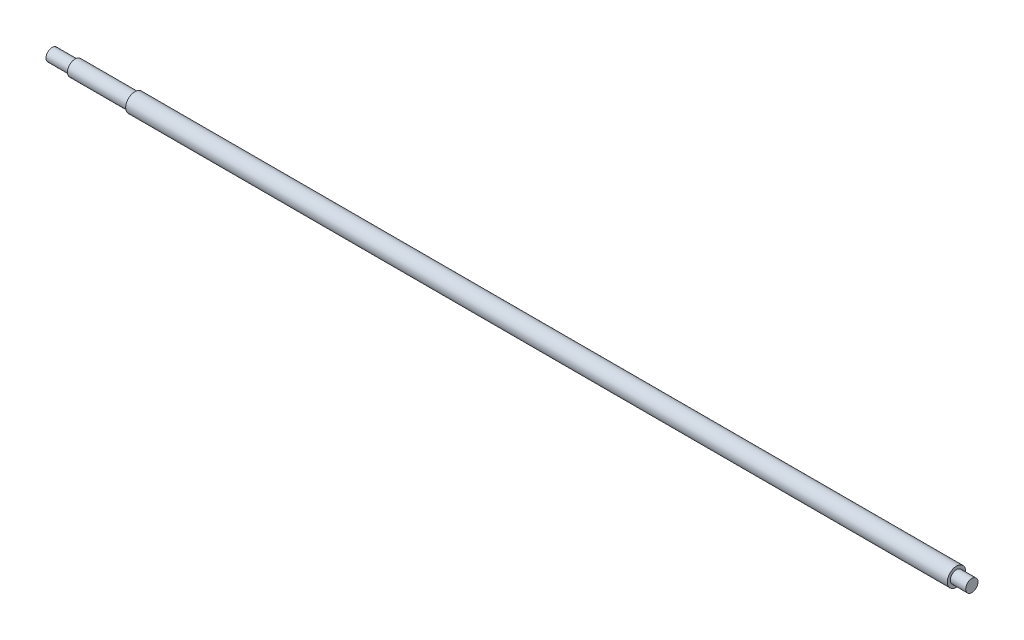
from build123d import *


with BuildPart() as part:
    # Sketch1 → Revolve1 (revolve)
    with BuildSketch(Plane.XY, mode=Mode.PRIVATE) as revolve1_sk:
        Polygon((0, 0), (0, 4), (15, 4), (15, 5), (54, 5), (54, 6), (590, 6), (590, 4), (600, 4), (600, 0), align=None)
    revolve(revolve1_sk.sketch.rotate(Axis((600, 0, 0), (-1, 0, 0)), 90), axis=Axis((600, 0, 0), (-1, 0, 0)))


solid = part.part
